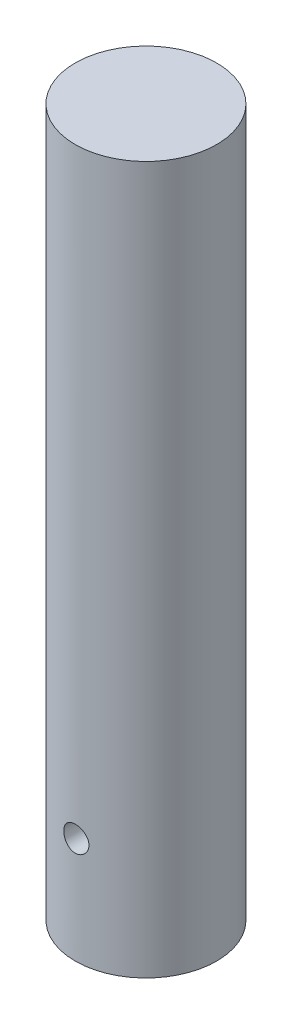
from build123d import *

# Parameters (mm, degrees)
SKETCH1_R           = 6.35
BOSS_EXTRUDE1_DEPTH = 63.5
SKETCH2_R           = 3.175
CUT_EXTRUDE1_DEPTH  = 19.05
SKETCH5_W           = 1.1303
SKETCH5_H           = 6.35


with BuildPart() as part:
    # Sketch1 → Boss-Extrude1 (new body)
    with BuildSketch(Plane(origin=(0, 0, 0), x_dir=(1, 0, 0), z_dir=(0, 1, 0))):
        with Locations(Location((0, 0, 0), (0, 0, 270))):
            Circle(SKETCH1_R)
    extrude(amount=BOSS_EXTRUDE1_DEPTH)

    # Sketch2 → Cut-Extrude1 (cut)
    with BuildSketch(Plane(origin=(0, 0, 0), x_dir=(1, 0, 0), z_dir=(0, 1, 0))):
        with Locations(Location((0, 0, 0), (0, 0, 90))):
            Circle(SKETCH2_R)
    extrude(amount=CUT_EXTRUDE1_DEPTH, mode=Mode.SUBTRACT)

    # Sketch5 → #43 (0.089) Diameter Hole1 (revolve, cut)
    with BuildSketch(Plane(origin=(0, 9.525, 0), x_dir=(0, 1, 0), z_dir=(1, 0, 0))):
        with Locations((0.56515, 3.175)):
            Rectangle(SKETCH5_W, SKETCH5_H)
    revolve(axis=Axis((0, 9.525, -6.35), (0, 0, 1)), mode=Mode.SUBTRACT)


solid = part.part
